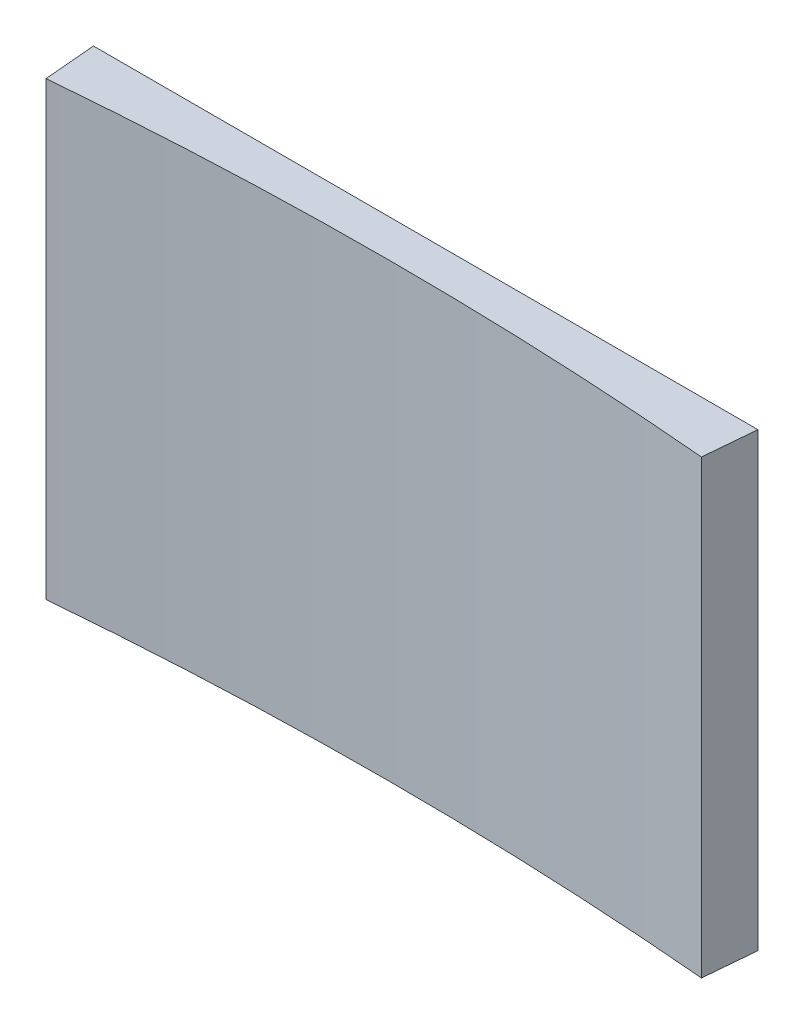
from build123d import *

# Parameters (mm, degrees)
BOSS_EXTRUDE1_DEPTH = 6


with BuildPart() as part:
    # Sketch1 → Boss-Extrude1 (new body)
    with BuildSketch(Plane(origin=(0, 0, 0), x_dir=(1, 0, 0), z_dir=(0, 1, 0))):
        with BuildLine():
            Line((-4.418177508, 50.5), (4.418177508, 50.5))
            Line((4.418177508, 50.5), (4.357787137, 49.809734905))
            ThreePointArc((4.357787137, 49.809734905), (0, 50), (-4.357787137, 49.809734905))
            Line((-4.357787137, 49.809734905), (-4.418177508, 50.5))
        make_face()
    extrude(amount=BOSS_EXTRUDE1_DEPTH)


solid = part.part
